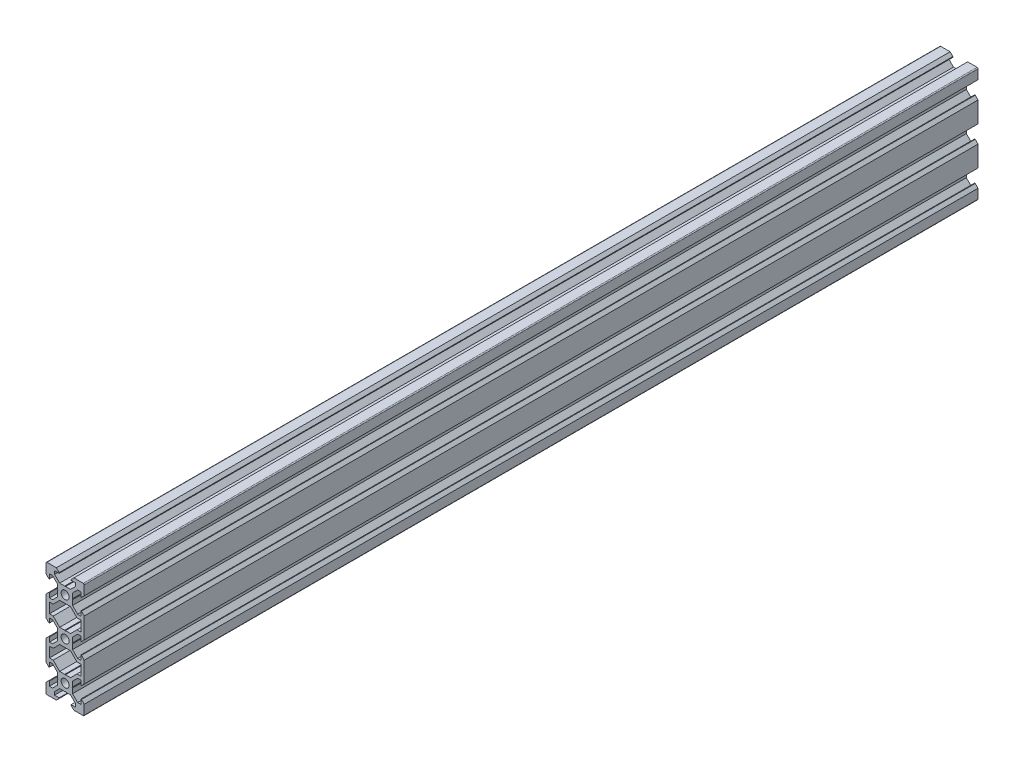
from build123d import *

# Parameters (mm, degrees)
BOSS_EXTRU_1_DEPTH = 467.7


with BuildPart() as part:
    # Esquisse1 → Boss.-Extru.1 (new body)
    with BuildSketch(Plane.XY):
        with BuildLine():
            Line((-9.5, 10), (-4.58, 10))
            Line((-4.58, 10), (-3.125, 8.545))
            Line((-3.125, 8.545), (-3.125, 8.2))
            Line((-3.125, 8.2), (-5.5, 8.2))
            Line((-5.5, 8.2), (-5.5, 6.560660172))
            Line((-5.5, 6.560660172), (-2.839339828, 3.9))
            Line((-2.839339828, 3.9), (-0.21, 3.9))
            Line((-0.21, 3.9), (0, 3.69))
            Line((0, 3.69), (0, 2.1))
            ThreePointArc((0, 2.1), (-2.1, 0), (0, -2.1))
            Line((0, -2.1), (0, -3.69))
            Line((0, -3.69), (-0.21, -3.9))
            Line((-0.21, -3.9), (-2.839339828, -3.9))
            Line((-2.839339828, -3.9), (-6.239339828, -7.3))
            Line((-6.239339828, -7.3), (-8.2, -7.3))
            Line((-8.2, -7.3), (-8.2, -12.7))
            Line((-8.2, -12.7), (-6.239339828, -12.7))
            Line((-6.239339828, -12.7), (-2.839339828, -16.1))
            Line((-2.839339828, -16.1), (-0.21, -16.1))
            Line((-0.21, -16.1), (0, -16.31))
            Line((0, -16.31), (0, -17.9))
            ThreePointArc((0, -17.9), (-2.1, -20), (0, -22.1))
            Line((0, -22.1), (0, -23.69))
            Line((0, -23.69), (-0.21, -23.9))
            Line((-0.21, -23.9), (-2.839339828, -23.9))
            Line((-2.839339828, -23.9), (-6.239339828, -27.3))
            Line((-6.239339828, -27.3), (-8.2, -27.3))
            Line((-8.2, -27.3), (-8.2, -32.7))
            Line((-8.2, -32.7), (-6.239339828, -32.7))
            Line((-6.239339828, -32.7), (-2.839339828, -36.1))
            Line((-2.839339828, -36.1), (-0.21, -36.1))
            Line((-0.21, -36.1), (0, -36.31))
            Line((0, -36.31), (0, -37.9))
            ThreePointArc((0, -37.9), (-2.1, -40), (0, -42.1))
            Line((0, -42.1), (0, -43.69))
            Line((0, -43.69), (-0.21, -43.9))
            Line((-0.21, -43.9), (-2.839339828, -43.9))
            Line((-2.839339828, -43.9), (-5.5, -46.560660172))
            Line((-5.5, -46.560660172), (-5.5, -48.2))
            Line((-5.5, -48.2), (-3.125, -48.2))
            Line((-3.125, -48.2), (-3.125, -48.545))
            Line((-3.125, -48.545), (-4.58, -50))
            Line((-4.58, -50), (-9.5, -50))
            ThreePointArc((-9.5, -50), (-9.853553391, -49.853553391), (-10, -49.5))
            Line((-10, -49.5), (-10, -44.58))
            Line((-10, -44.58), (-8.545, -43.125))
            Line((-8.545, -43.125), (-8.2, -43.125))
            Line((-8.2, -43.125), (-8.2, -45.5))
            Line((-8.2, -45.5), (-6.560660172, -45.5))
            Line((-6.560660172, -45.5), (-3.9, -42.839339828))
            Line((-3.9, -42.839339828), (-3.9, -40.21))
            Line((-3.9, -40.21), (-3.69, -40))
            Line((-3.69, -40), (-3.9, -39.79))
            Line((-3.9, -39.79), (-3.9, -37.160660172))
            Line((-3.9, -37.160660172), (-6.560660172, -34.5))
            Line((-6.560660172, -34.5), (-8.2, -34.5))
            Line((-8.2, -34.5), (-8.2, -36.875))
            Line((-8.2, -36.875), (-8.545, -36.875))
            Line((-8.545, -36.875), (-10, -35.42))
            Line((-10, -35.42), (-10, -24.58))
            Line((-10, -24.58), (-8.545, -23.125))
            Line((-8.545, -23.125), (-8.2, -23.125))
            Line((-8.2, -23.125), (-8.2, -25.5))
            Line((-8.2, -25.5), (-6.560660172, -25.5))
            Line((-6.560660172, -25.5), (-3.9, -22.839339828))
            Line((-3.9, -22.839339828), (-3.9, -20.21))
            Line((-3.9, -20.21), (-3.69, -20))
            Line((-3.69, -20), (-3.9, -19.79))
            Line((-3.9, -19.79), (-3.9, -17.160660172))
            Line((-3.9, -17.160660172), (-6.560660172, -14.5))
            Line((-6.560660172, -14.5), (-8.2, -14.5))
            Line((-8.2, -14.5), (-8.2, -16.875))
            Line((-8.2, -16.875), (-8.545, -16.875))
            Line((-8.545, -16.875), (-10, -15.42))
            Line((-10, -15.42), (-10, -4.58))
            Line((-10, -4.58), (-8.545, -3.125))
            Line((-8.545, -3.125), (-8.2, -3.125))
            Line((-8.2, -3.125), (-8.2, -5.5))
            Line((-8.2, -5.5), (-6.560660172, -5.5))
            Line((-6.560660172, -5.5), (-3.9, -2.839339828))
            Line((-3.9, -2.839339828), (-3.9, -0.21))
            Line((-3.9, -0.21), (-3.69, 0))
            Line((-3.69, 0), (-3.9, 0.21))
            Line((-3.9, 0.21), (-3.9, 2.839339828))
            Line((-3.9, 2.839339828), (-6.560660172, 5.5))
            Line((-6.560660172, 5.5), (-8.2, 5.5))
            Line((-8.2, 5.5), (-8.2, 3.125))
            Line((-8.2, 3.125), (-8.545, 3.125))
            Line((-8.545, 3.125), (-10, 4.58))
            Line((-10, 4.58), (-10, 9.5))
            ThreePointArc((-10, 9.5), (-9.853553391, 9.853553391), (-9.5, 10))
        make_face()
    boss_extru_1 = extrude(amount=BOSS_EXTRU_1_DEPTH)

    # Symétrie1: Boss.-Extru.1 across plane
    add(boss_extru_1.mirror(Plane(origin=(0, 3.69, 467.7), x_dir=(0, 0, 1), z_dir=(-1, 0, 0))))


solid = part.part
